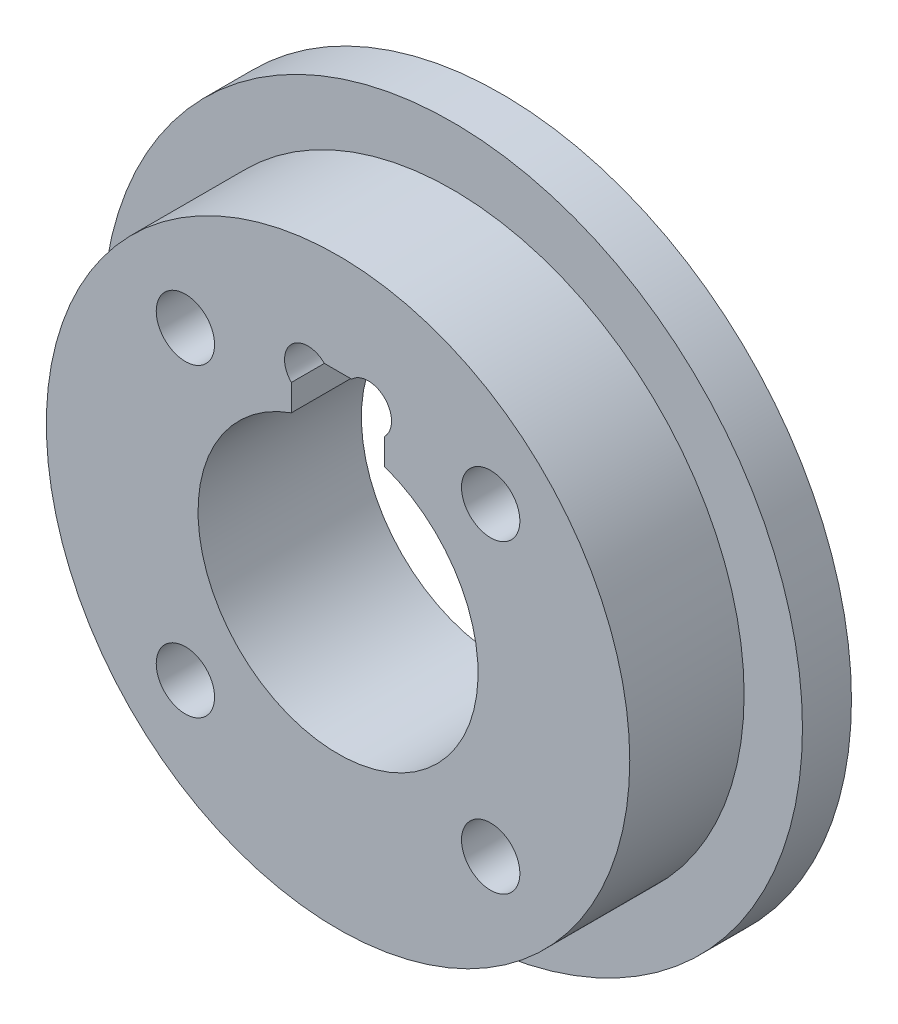
from build123d import *

# Parameters (mm, degrees)
SKETCH_1_12_R       = 15
EXTRUDE_2_DEPTH     = 7
SKETCH_1_13_R       = 15
SKETCH_1_13_R_2     = 12.5
CUT_EXTRUDE_5_DEPTH = 4.9
M3X0_5_2_D          = 2.5


with BuildPart() as part:
    # ｽｹｯﾁ1<12> → ﾎﾞｽ - 押し出し2 (new body)
    with BuildSketch(Plane.XY):
        Circle(SKETCH_1_12_R)
        with BuildLine():
            Line((-2, 6.785786438), (-2, 5.656854249))
            ThreePointArc((-2, 5.656854249), (0, -6), (2, 5.656854249))
            Line((2, 5.656854249), (2, 6.785786438))
            ThreePointArc((2, 6.785786438), (2, 8.2), (0.585786438, 8.2))
            Line((0.585786438, 8.2), (-0.585786438, 8.2))
            ThreePointArc((-0.585786438, 8.2), (-2, 8.2), (-2, 6.785786438))
        make_face(mode=Mode.SUBTRACT)
    extrude(amount=-EXTRUDE_2_DEPTH)

    # ｽｹｯﾁ1<13> → ｶｯﾄ - 押し出し5 (cut)
    with BuildSketch(Plane.XY):
        Circle(SKETCH_1_13_R)
        Circle(SKETCH_1_13_R_2, mode=Mode.SUBTRACT)
    extrude(amount=-CUT_EXTRUDE_5_DEPTH, mode=Mode.SUBTRACT)

    # M3x0.5 ねじ穴2 (through all)
    with Locations(Plane(origin=(-6.540737726, 6.540737726, -7), x_dir=(-1, 0, 0), z_dir=(0, 0, -1))):
        with Locations((0, 0), (0, -13.081475452), (-13.081475452, -13.081475452), (-13.081475452, 0)):
            Hole(M3X0_5_2_D / 2)


solid = part.part
